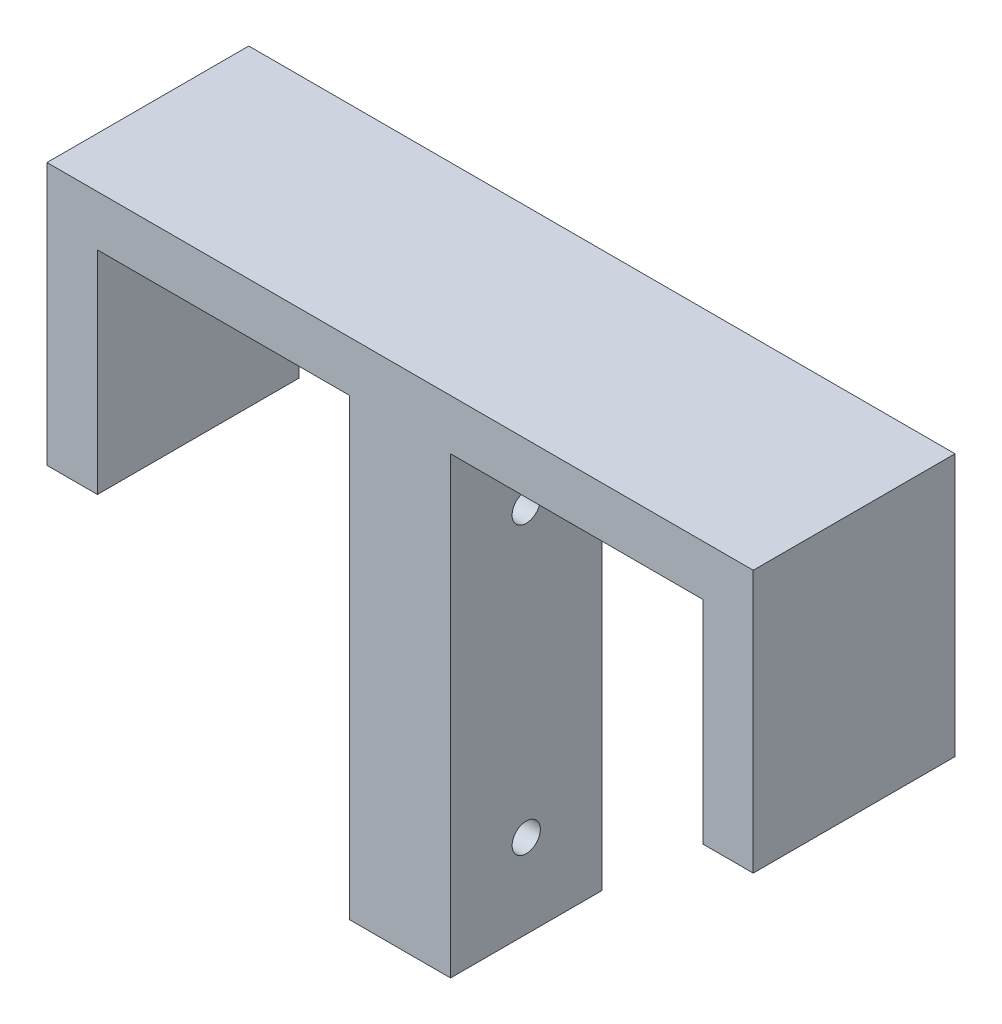
from build123d import *

# Parameters (mm, degrees)
SKETCH1_W           = 6.35
SKETCH1_H           = 28.575
BOSS_EXTRUDE1_DEPTH = 9.525
SKETCH3_W           = 3.175
SKETCH3_H           = 13.335
BOSS_EXTRUDE2_DEPTH = 12.7
CUT_EXTRUDE1_REACH  = 34.262
SKETCH4_R           = 0.889


with BuildPart() as part:
    # Sketch1 → Boss-Extrude1 (new body)
    with BuildSketch(Plane.XY):
        Rectangle(SKETCH1_W, SKETCH1_H)
    extrude(amount=BOSS_EXTRUDE1_DEPTH)

    # Sketch3 → Boss-Extrude2 (add)
    with BuildSketch(Plane.XY.offset(9.525)):
        with Locations((-20.6375, 7.62)):
            Rectangle(SKETCH3_W, SKETCH3_H)
        Polygon((22.225, 17.4625), (-22.225, 17.4625), (-22.225, 14.2875), (-19.05, 14.2875), (-3.175, 14.2875), (3.175, 14.2875), (19.05, 14.2875), (22.225, 14.2875), align=None)
        with Locations((20.6375, 7.62)):
            Rectangle(SKETCH3_W, SKETCH3_H)
    extrude(amount=-BOSS_EXTRUDE2_DEPTH)

    # Sketch4 → Cut-Extrude1 (cut, up to next)
    with BuildSketch(Plane(origin=(3.175, 0, 0), x_dir=(0, 0, -1), z_dir=(1, 0, 0)), mode=Mode.PRIVATE) as cut_extrude1_sk1:
        with Locations((-4.7625, -9.0043)):
            Circle(SKETCH4_R)
    cut_extrude1_tool1 = extrude(cut_extrude1_sk1.sketch, amount=-CUT_EXTRUDE1_REACH, mode=Mode.PRIVATE) & part.part
    # Sketch4 → Cut-Extrude1 (cut, up to next)
    with BuildSketch(Plane(origin=(3.175, 0, 0), x_dir=(0, 0, -1), z_dir=(1, 0, 0)), mode=Mode.PRIVATE) as cut_extrude1_sk2:
        with Locations((-4.7625, 9.0043)):
            Circle(SKETCH4_R)
    cut_extrude1_tool2 = extrude(cut_extrude1_sk2.sketch, amount=-CUT_EXTRUDE1_REACH, mode=Mode.PRIVATE) & part.part
    add(cut_extrude1_tool1.solids().sort_by_distance((3.175, -9.0043, 4.7625))[0], mode=Mode.SUBTRACT)
    add(cut_extrude1_tool2.solids().sort_by_distance((3.175, 9.0043, 4.7625))[0], mode=Mode.SUBTRACT)


solid = part.part
